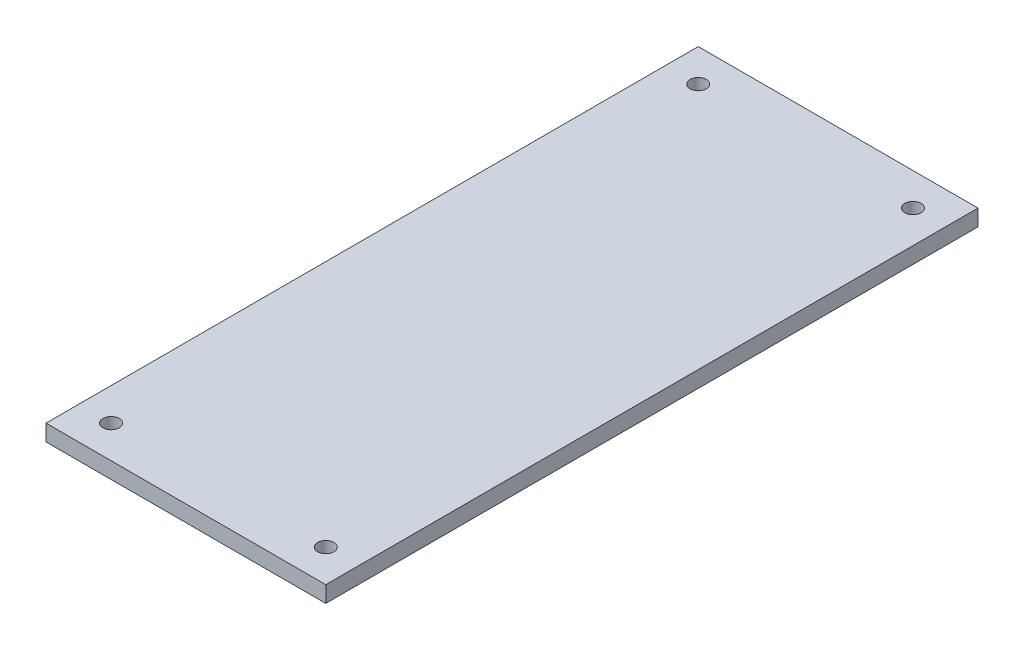
from build123d import *

# Parameters (mm, degrees)
SKETCH_1_W          = 86
SKETCH_1_H          = 200.5
EXTRUDE_1_DEPTH     = 5
SKETCH_2_R          = 2.5
CUT_EXTRUDE_1_DEPTH = 110.197355737


with BuildPart() as part:
    # 스케치1 → 보스-돌출1 (new body)
    with BuildSketch(Plane(origin=(0, 0, 0), x_dir=(1, 0, 0), z_dir=(0, 1, 0))):
        Rectangle(SKETCH_1_W, SKETCH_1_H)
    extrude(amount=EXTRUDE_1_DEPTH)

    # 스케치2 → 컷-돌출1 (cut, through all)
    with BuildSketch(Plane(origin=(0, 5, 0), x_dir=(1, 0, 0), z_dir=(0, 1, 0))):
        with Locations(Location((-33, 90.25, 0), (0, 0, 270))):
            Circle(SKETCH_2_R)
        with Locations(Location((33, 90.25, 0), (0, 0, 270))):
            Circle(SKETCH_2_R)
        with Locations(Location((-33, -90.25, 0), (0, 0, 270))):
            Circle(SKETCH_2_R)
        with Locations(Location((33, -90.25, 0), (0, 0, 270))):
            Circle(SKETCH_2_R)
    extrude(amount=-CUT_EXTRUDE_1_DEPTH, mode=Mode.SUBTRACT)


solid = part.part
